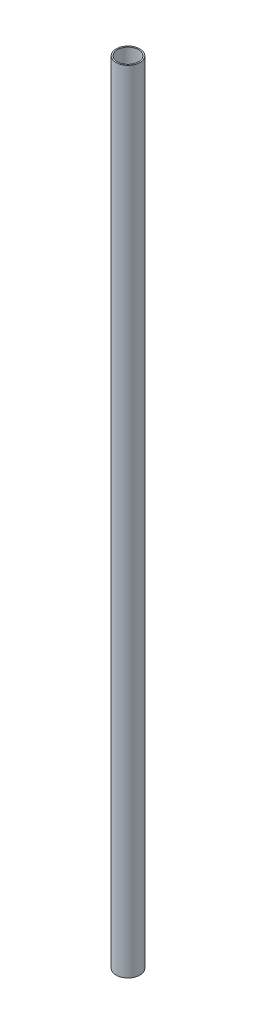
from build123d import *

# Parameters (mm, degrees)
SKETCH2_R           = 7.9375
SKETCH2_R_2         = 7.0485
BOSS_EXTRUDE1_DEPTH = 527.05


with BuildPart() as part:
    # Sketch2 → Boss-Extrude1 (new body)
    with BuildSketch(Plane(origin=(0, 0, 0), x_dir=(1, 0, 0), z_dir=(0, 1, 0))):
        with Locations(Location((0, 0, 0), (0, 0, 270))):
            Circle(SKETCH2_R)
        with Locations(Location((0, 0, 0), (0, 0, 270))):
            Circle(SKETCH2_R_2, mode=Mode.SUBTRACT)
    extrude(amount=BOSS_EXTRUDE1_DEPTH)


solid = part.part
